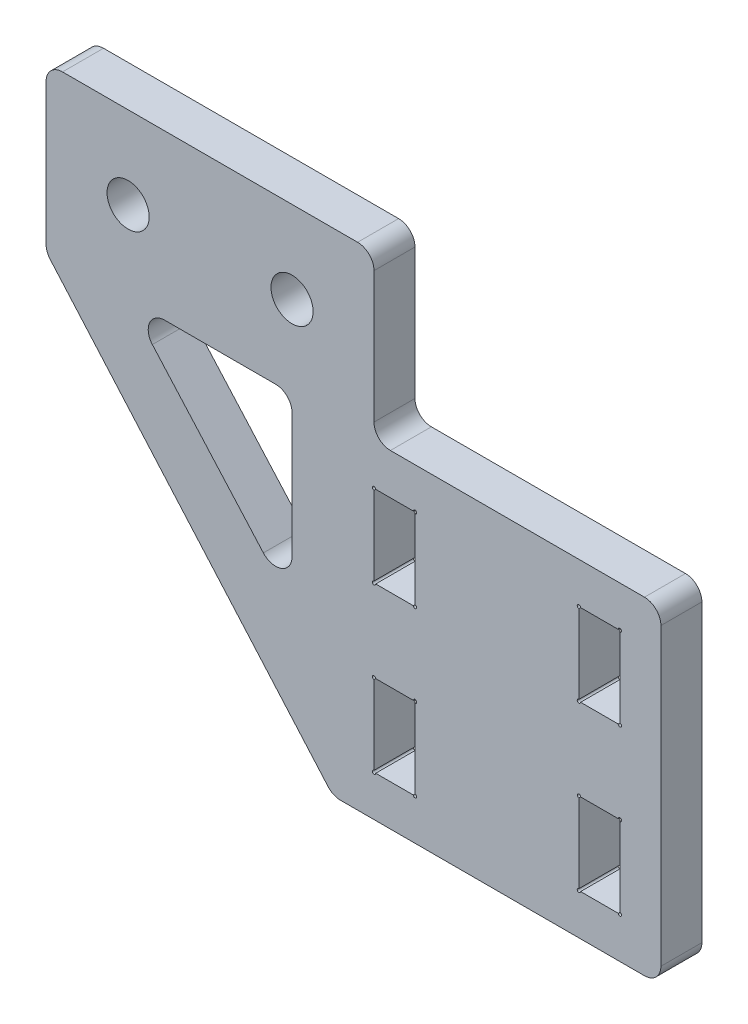
from build123d import *

# Parameters (mm, degrees)
BOSS_EXTRUDE1_DEPTH      = 6.35
FILLET1_R                = 2.54
FILLET2_R                = 2.54
F_0_257_DIAMETER_HOLE1_D = 6.5278


with BuildPart() as part:
    # Sketch1 → Boss-Extrude1 (new body)
    with BuildSketch(Plane.XY):
        Polygon((-6.35, 0), (0, 0), (44.45, 0), (44.45, 32.01), (44.45, 44.19), (44.45, 50.8), (0, 50.8), (0, 76.2), (-50.8, 76.2), (-50.8, 50.8), align=None)
        Polygon((-12.7, 22.225), (-38.1, 50.8), (-12.7, 50.8), align=None, mode=Mode.SUBTRACT)
        with BuildLine():
            ThreePointArc((0.26, 6.35), (-0.183847763, 6.166152237), (0, 6.61))
            Line((0, 6.61), (0, 18.79))
            ThreePointArc((0, 18.79), (-0.183847763, 19.233847763), (0.26, 19.05))
            Line((0.26, 19.05), (6.09, 19.05))
            ThreePointArc((6.09, 19.05), (6.533847763, 19.233847763), (6.35, 18.79))
            Line((6.35, 18.79), (6.35, 6.61))
            ThreePointArc((6.35, 6.61), (6.533847763, 6.166152237), (6.09, 6.35))
            Line((6.09, 6.35), (0.26, 6.35))
        make_face(mode=Mode.SUBTRACT)
        with BuildLine():
            Line((31.75, 6.61), (31.75, 18.79))
            ThreePointArc((31.75, 18.79), (31.566152237, 19.233847763), (32.01, 19.05))
            Line((32.01, 19.05), (37.84, 19.05))
            ThreePointArc((37.84, 19.05), (38.283847763, 19.233847763), (38.1, 18.79))
            Line((38.1, 18.79), (38.1, 6.61))
            ThreePointArc((38.1, 6.61), (38.283847763, 6.166152237), (37.84, 6.35))
            Line((37.84, 6.35), (32.01, 6.35))
            ThreePointArc((32.01, 6.35), (31.566152237, 6.166152237), (31.75, 6.61))
        make_face(mode=Mode.SUBTRACT)
        with BuildLine():
            ThreePointArc((0, 44.19), (-0.183847763, 44.633847763), (0.26, 44.45))
            Line((0.26, 44.45), (6.09, 44.45))
            ThreePointArc((6.09, 44.45), (6.533847763, 44.633847763), (6.35, 44.19))
            Line((6.35, 44.19), (6.35, 32.01))
            ThreePointArc((6.35, 32.01), (6.533847763, 31.566152237), (6.09, 31.75))
            Line((6.09, 31.75), (0.26, 31.75))
            ThreePointArc((0.26, 31.75), (-0.183847763, 31.566152237), (0, 32.01))
            Line((0, 32.01), (0, 44.19))
        make_face(mode=Mode.SUBTRACT)
        with BuildLine():
            Line((38.1, 44.19), (38.1, 32.01))
            ThreePointArc((38.1, 32.01), (38.283847763, 31.566152237), (37.84, 31.75))
            Line((37.84, 31.75), (32.01, 31.75))
            ThreePointArc((32.01, 31.75), (31.566152237, 31.566152237), (31.75, 32.01))
            Line((31.75, 32.01), (31.75, 44.19))
            ThreePointArc((31.75, 44.19), (31.566152237, 44.633847763), (32.01, 44.45))
            Line((32.01, 44.45), (37.84, 44.45))
            ThreePointArc((37.84, 44.45), (38.283847763, 44.633847763), (38.1, 44.19))
        make_face(mode=Mode.SUBTRACT)
    extrude(amount=BOSS_EXTRUDE1_DEPTH)

    # Fillet1
    fillet1_edges = [part.edges().sort_by_distance(p)[0] for p in [
        (44.45, 0, 3.175),
        (-6.35, 0, 3.175),
        (-50.8, 50.8, 3.175),
        (-50.8, 76.2, 3.175),
        (0, 76.2, 3.175),
        (0, 50.8, 3.175),
        (44.45, 50.8, 3.175),
    ]]
    fillet(fillet1_edges, radius=FILLET1_R)

    # Fillet2
    fillet2_edges = [part.edges().sort_by_distance(p)[0] for p in [
        (-12.7, 22.225, 3.175),
        (-12.7, 50.8, 3.175),
        (-38.1, 50.8, 3.175),
    ]]
    fillet(fillet2_edges, radius=FILLET2_R)

    # F (0.257) Diameter Hole1 (through all)
    with Locations(Plane.XY.offset(6.35)):
        with Locations((-38.1, 63.44747919), (-12.7, 63.44747919)):
            Hole(F_0_257_DIAMETER_HOLE1_D / 2)


solid = part.part
